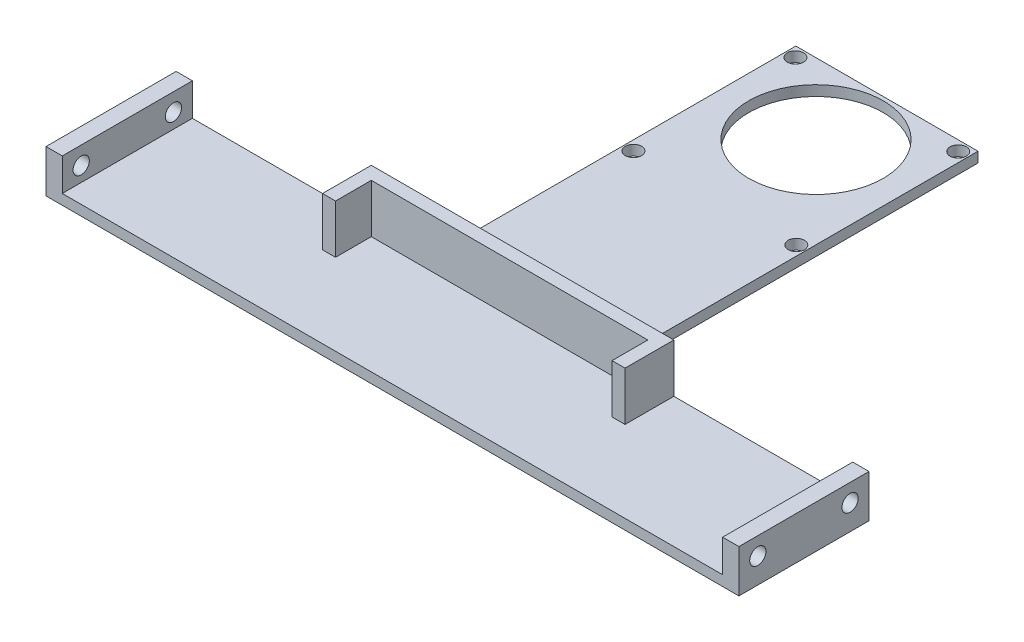
from build123d import *

# Parameters (mm, degrees)
SKETCH2_W           = 59.055
SKETCH2_H           = 25.4
BOSS_EXTRUDE1_DEPTH = 2
BOSS_EXTRUDE2_START = 2
BOSS_EXTRUDE2_DEPTH = 9.525
SKETCH3_W           = 38.1
SKETCH3_H           = 25.4
BOSS_EXTRUDE3_DEPTH = 2
BOSS_EXTRUDE4_START = 2
SKETCH4_W           = 3.175
SKETCH4_H           = 25.4
BOSS_EXTRUDE4_DEPTH = 6.35
SKETCH5_R           = 1.5875
CUT_EXTRUDE1_DEPTH  = 3.175
SKETCH6_W           = 35.56
SKETCH6_H           = 71.12
SKETCH6_R           = 1.5875
BOSS_EXTRUDE5_DEPTH = 2
FILLET1_R           = 2.54
SKETCH10_R          = 13.129221829
CUT_EXTRUDE2_DEPTH  = 2


with BuildPart() as part:
    # Sketch2 → Boss-Extrude1 (new body)
    with BuildSketch(Plane(origin=(0, 0, 0), x_dir=(1, 0, 0), z_dir=(0, 1, 0))):
        with Locations((26.9875, 154.94)):
            Rectangle(SKETCH2_W, SKETCH2_H)
    extrude(amount=BOSS_EXTRUDE1_DEPTH)

    # Sketch1 → Boss-Extrude2 (add)
    with BuildSketch(Plane(origin=(0, 0, 0), x_dir=(1, 0, 0), z_dir=(0, 1, 0)).offset(BOSS_EXTRUDE2_START)):
        Polygon((-2.54, 167.64), (-2.54, 158.115), (0, 158.115), (0, 165.1), (53.975, 165.1), (53.975, 158.115), (56.515, 158.115), (56.515, 167.64), align=None)
    extrude(amount=BOSS_EXTRUDE2_DEPTH)

    # Sketch3 → Boss-Extrude3 (add)
    with BuildSketch(Plane(origin=(0, 0, 0), x_dir=(1, 0, 0), z_dir=(0, 1, 0))):
        with Locations((75.565, 154.94)):
            Rectangle(SKETCH3_W, SKETCH3_H)
    extrude(amount=BOSS_EXTRUDE3_DEPTH)

    # Sketch4 → Boss-Extrude4 (add)
    with BuildSketch(Plane(origin=(0, 0, 0), x_dir=(1, 0, 0), z_dir=(0, 1, 0)).offset(BOSS_EXTRUDE4_START)):
        with Locations((93.0275, 154.94)):
            Rectangle(SKETCH4_W, SKETCH4_H)
    extrude(amount=BOSS_EXTRUDE4_DEPTH)

    # Sketch5 → Cut-Extrude1 (cut)
    with BuildSketch(Plane(origin=(94.615, 0, 0), x_dir=(0, 0, -1), z_dir=(1, 0, 0))):
        with Locations((145.94, 4.895971622)):
            Circle(SKETCH5_R)
        with Locations(Location((163.94, 4.895971622, 0), (0, 0, 180))):
            Circle(SKETCH5_R)
    extrude(amount=-CUT_EXTRUDE1_DEPTH, mode=Mode.SUBTRACT)

    # Mirror1: part across plane


with BuildPart() as part_1:
    add(part.part)
    add(part.part.mirror(Plane(origin=(26.9875, 0, 0), x_dir=(0, 0, 1), z_dir=(1, 0, 0))))

    # Sketch6 → Boss-Extrude5 (add)
    with BuildSketch(Plane(origin=(0, 0, 0), x_dir=(1, 0, 0), z_dir=(0, 1, 0))):
        with Locations((26.9875, 203.2)):
            Rectangle(SKETCH6_W, SKETCH6_H)
        with Locations(Location((11.09051688, 236.783908574, 0), (0, 0, 270))):
            Circle(SKETCH6_R, mode=Mode.SUBTRACT)
        with Locations(Location((11.09051688, 205.176091426, 0), (0, 0, 90))):
            Circle(SKETCH6_R, mode=Mode.SUBTRACT)
        with Locations(Location((42.88448312, 205.176091426, 0), (0, 0, 270))):
            Circle(SKETCH6_R, mode=Mode.SUBTRACT)
        with Locations(Location((42.88448312, 236.783908574, 0), (0, 0, 90))):
            Circle(SKETCH6_R, mode=Mode.SUBTRACT)
    extrude(amount=BOSS_EXTRUDE5_DEPTH)

    # Fillet1
    fillet1_edges = [part_1.edges().sort_by_distance(p)[0] for p in [
        (26.9875, 2, -167.64),
    ]]
    fillet(fillet1_edges, radius=FILLET1_R)

    # Sketch10 → Cut-Extrude2 (cut)
    with BuildSketch(Plane(origin=(0, 2, 0), x_dir=(1, 0, 0), z_dir=(0, 1, 0))):
        with Locations(Location((26.9875, 224.917, 0), (0, 0, 270))):
            Circle(SKETCH10_R)
    extrude(amount=-CUT_EXTRUDE2_DEPTH, mode=Mode.SUBTRACT)


solid = part_1.part
